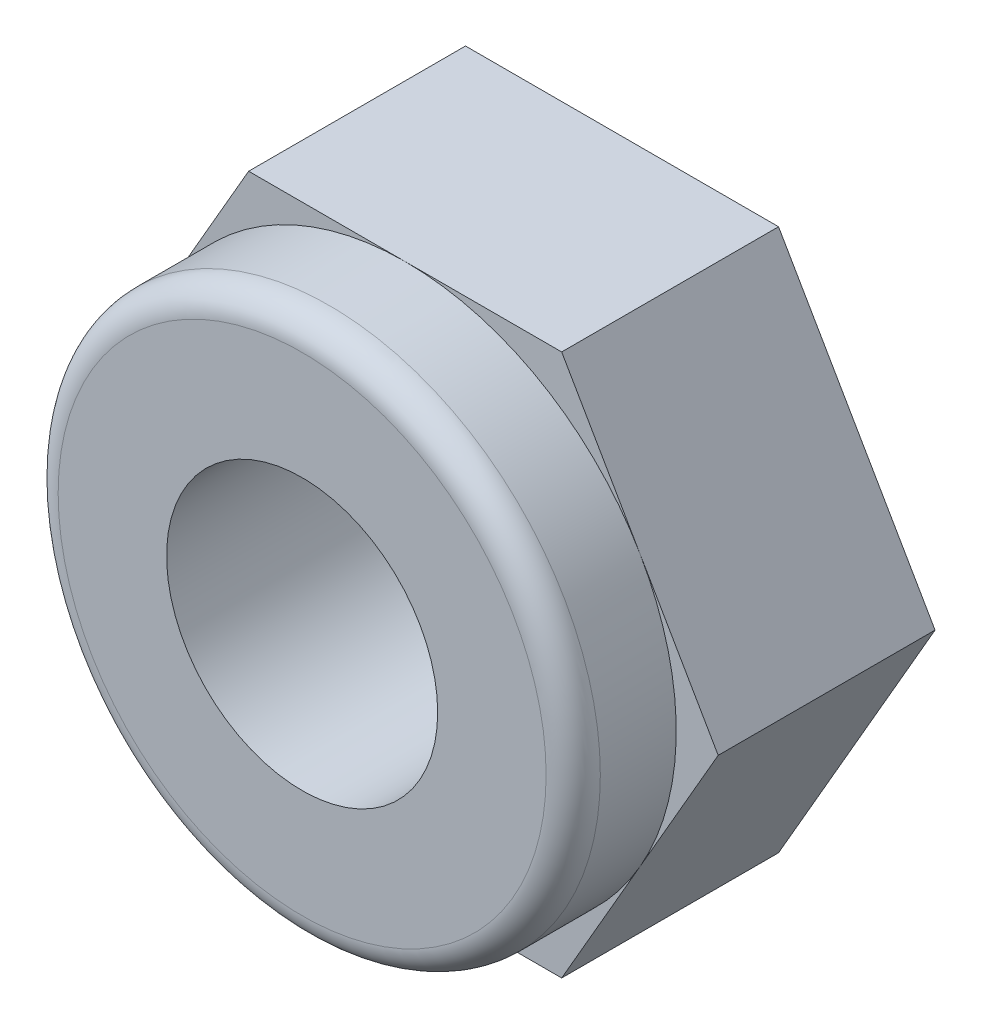
from build123d import *

# Parameters (mm, degrees)
EXTRUDE_1_DEPTH    = 4
SKETCH_2_R         = 5
EXTRUDE_2_DEPTH    = 1.9
HOLE_WIZARD_M6_1_D = 5
FILLET_1_R         = 0.5


with BuildPart() as part:
    # 草图1 → 凸台-拉伸1 (new body)
    with BuildSketch(Plane.XY):
        Polygon((5.773502692, 0), (2.886751346, 5), (-2.886751346, 5), (-5.773502692, 0), (-2.886751346, -5), (2.886751346, -5), align=None)
    extrude(amount=EXTRUDE_1_DEPTH)

    # 草图2 → 凸台-拉伸2 (add)
    with BuildSketch(Plane.XY.offset(4)):
        with Locations(Location((0, 0, 0), (0, 0, 210))):
            Circle(SKETCH_2_R)
    extrude(amount=EXTRUDE_2_DEPTH)

    # M6 螺纹孔1 (through all)
    with Locations(Plane.XY.offset(5.9)):
        with Locations((0, 0)):
            Hole(HOLE_WIZARD_M6_1_D / 2)

    # 圆角1
    fillet_1_edges = [part.edges().sort_by_distance(p)[0] for p in [
        (4.330127019, 2.5, 5.9),
    ]]
    fillet(fillet_1_edges, radius=FILLET_1_R)


solid = part.part
